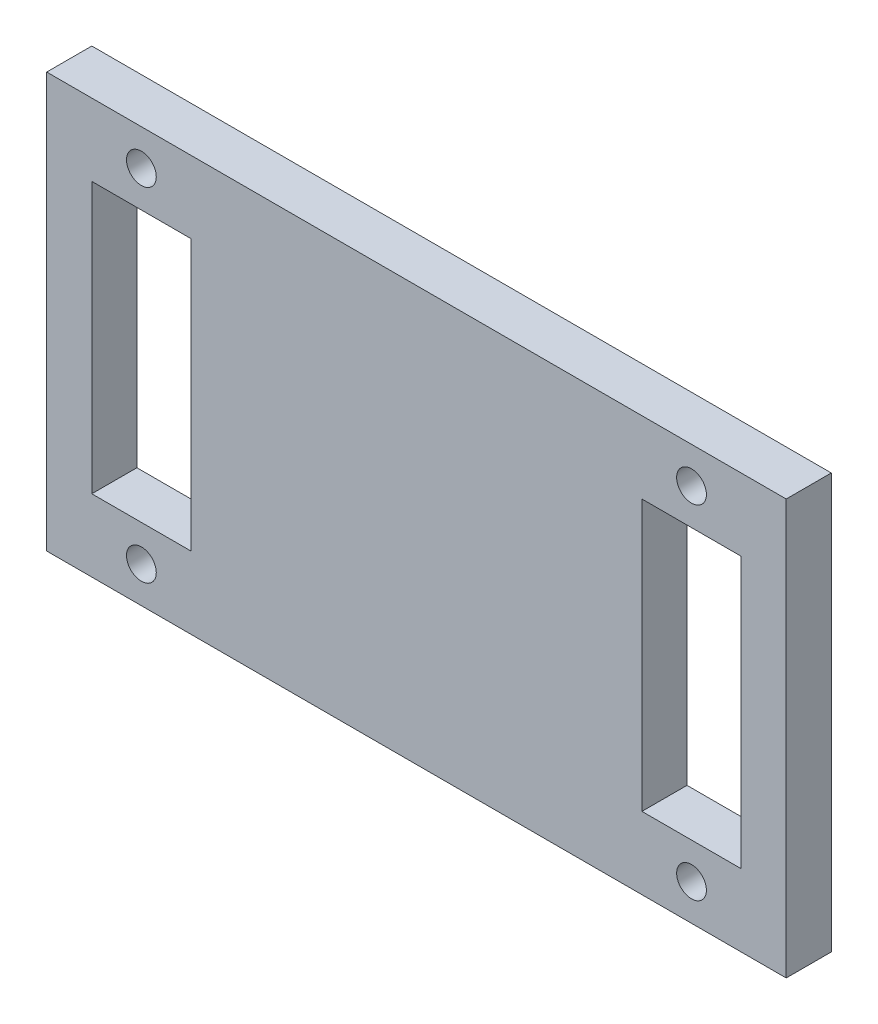
from build123d import *

# Parameters (mm, degrees)
ESQUISSE1_W        = 82
ESQUISSE1_H        = 46
ESQUISSE1_R        = 1.65
ESQUISSE1_W_2      = 11
ESQUISSE1_H_2      = 30
BOSS_EXTRU_1_DEPTH = 5


with BuildPart() as part:
    # Esquisse1 → Boss.-Extru.1 (new body)
    with BuildSketch(Plane.XY):
        with Locations((-41, 59.910969495)):
            Rectangle(ESQUISSE1_W, ESQUISSE1_H)
        with Locations((-10.5, 40.910969495)):
            Circle(ESQUISSE1_R, mode=Mode.SUBTRACT)
        with Locations((-10.5, 78.910969495)):
            Circle(ESQUISSE1_R, mode=Mode.SUBTRACT)
        with Locations((-71.5, 40.910969495)):
            Circle(ESQUISSE1_R, mode=Mode.SUBTRACT)
        with Locations((-71.5, 78.910969495)):
            Circle(ESQUISSE1_R, mode=Mode.SUBTRACT)
        with Locations((-71.5, 59.910969495)):
            Rectangle(ESQUISSE1_W_2, ESQUISSE1_H_2, mode=Mode.SUBTRACT)
        with Locations((-10.5, 59.910969495)):
            Rectangle(ESQUISSE1_W_2, ESQUISSE1_H_2, mode=Mode.SUBTRACT)
    extrude(amount=BOSS_EXTRU_1_DEPTH)


solid = part.part
